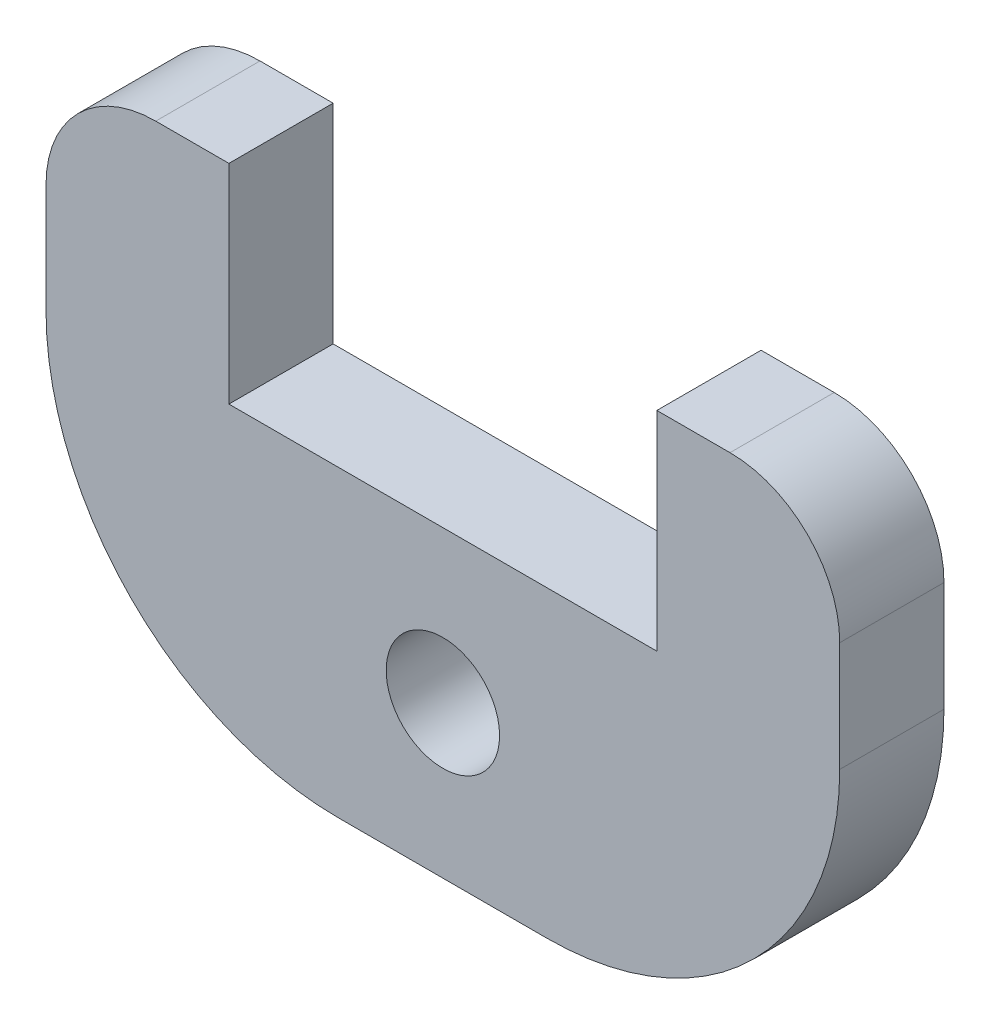
from build123d import *

# Parameters (mm, degrees)
BOSS_EXTRUDE1_DEPTH = 2.85
SKETCH2_R           = 1.55
CUT_EXTRUDE1_DEPTH  = 14.222896808
FILLET1_R           = 8
FILLET2_R           = 3


with BuildPart() as part:
    # Sketch1 → Boss-Extrude1 (new body)
    with BuildSketch(Plane.XY):
        Polygon((5.85, 7), (10.85, 7), (10.85, -7), (-10.85, -7), (-10.85, 7), (-5.85, 7), (-5.85, 1.3), (5.85, 1.3), align=None)
    extrude(amount=BOSS_EXTRUDE1_DEPTH)

    # Sketch2 → Cut-Extrude1 (cut, through all)
    with BuildSketch(Plane.XY.offset(2.85)):
        with Locations((0, -2.85)):
            Circle(SKETCH2_R)
    extrude(amount=-CUT_EXTRUDE1_DEPTH, mode=Mode.SUBTRACT)

    # Fillet1
    fillet1_edges = [part.edges().sort_by_distance(p)[0] for p in [
        (10.85, -7, 1.425),
        (-10.85, -7, 1.425),
    ]]
    fillet(fillet1_edges, radius=FILLET1_R)

    # Fillet2
    fillet2_edges = [part.edges().sort_by_distance(p)[0] for p in [
        (-10.85, 7, 1.425),
        (10.85, 7, 1.425),
    ]]
    fillet(fillet2_edges, radius=FILLET2_R)


solid = part.part
